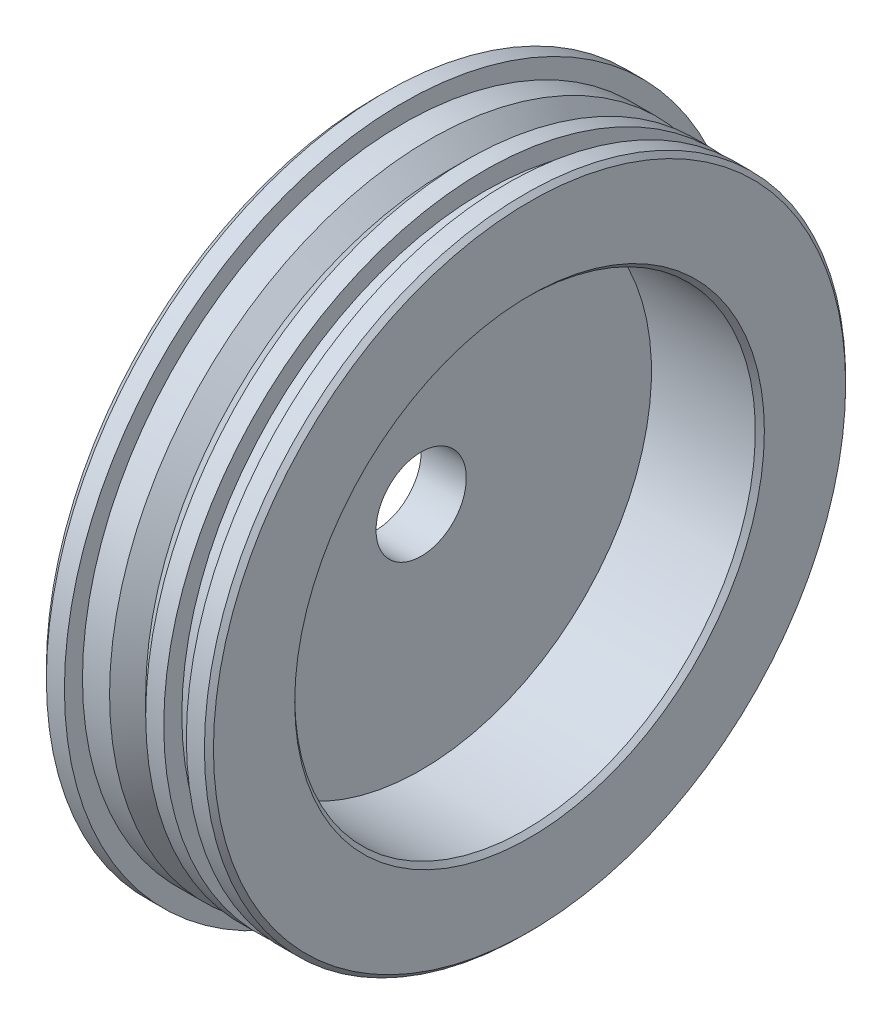
from build123d import *

# Parameters (mm, degrees)
SKETCH_2_R          = 5
CUT_EXTRUDE_1_DEPTH = 10


with BuildPart() as part:
    # Эскиз1 → Повернуть1 (revolve)
    with BuildSketch(Plane.XY, mode=Mode.PRIVATE) as revolve_1_sk:
        Polygon((-5, 0), (-5, 36.5), (-4, 37.5), (-2, 37.5), (-2, 35.5), (1, 35.5), (3, 33.5), (5, 35.5), (7, 35.5), (7, 33.5), (9.5, 33.5), (9.5, 35.5), (11.5, 35.5), (12, 35), (12, 26), (11.5, 25.5), (0, 25.5), (0, 0), align=None)
    revolve(revolve_1_sk.sketch.rotate(Axis((0, 0, 0), (1, 0, 0)), 90), axis=Axis((0, 0, 0), (1, 0, 0)))

    # Эскиз2 → Вырез-Вытянуть1 (cut)
    with BuildSketch(Plane.ZY.offset(5)):
        Circle(SKETCH_2_R)
    extrude(amount=-CUT_EXTRUDE_1_DEPTH, mode=Mode.SUBTRACT)


solid = part.part
